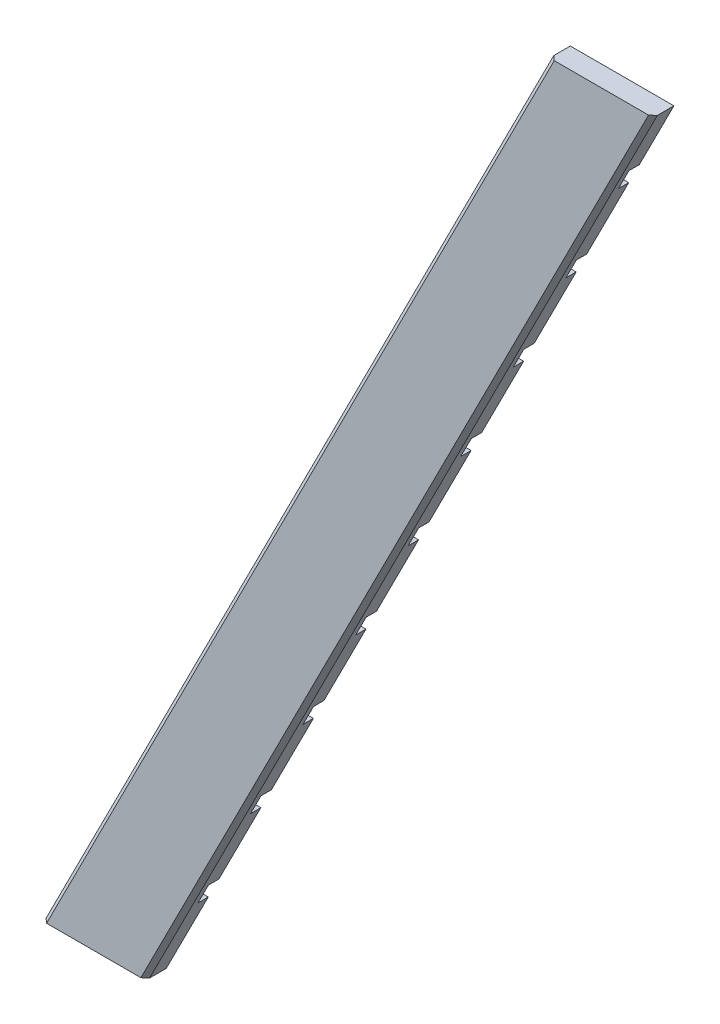
from build123d import *

# Parameters (mm, degrees)
EXTRUDE_1_DEPTH     = 1
SKETCH_2_W          = 34.447182458
SKETCH_2_H          = 1
CUT_EXTRUDE_1_DEPTH = 0.5
CHAMFER_1_SIZE      = 0.2


with BuildPart() as part:
    # Эскиз1 → Бобышка-Вытянуть1 (new body)
    with BuildSketch(Plane.XY):
        Polygon((0, 0), (24.5, 48.3), (19.5, 48.3), (-5, 0), align=None)
    extrude(amount=EXTRUDE_1_DEPTH)

    # Эскиз2 → Вырез-Вытянуть1 (cut)
    with BuildSketch(Plane.XY.offset(1)):
        with Locations((13.095064359, 4.5)):
            Rectangle(SKETCH_2_W, SKETCH_2_H)
        with Locations((13.095064359, 9.5)):
            Rectangle(SKETCH_2_W, SKETCH_2_H)
        with Locations((13.095064359, 14.5)):
            Rectangle(SKETCH_2_W, SKETCH_2_H)
        with Locations((13.095064359, 19.5)):
            Rectangle(SKETCH_2_W, SKETCH_2_H)
        with Locations((13.095064359, 24.5)):
            Rectangle(SKETCH_2_W, SKETCH_2_H)
        with Locations((13.095064359, 29.5)):
            Rectangle(SKETCH_2_W, SKETCH_2_H)
        with Locations((13.095064359, 34.5)):
            Rectangle(SKETCH_2_W, SKETCH_2_H)
        with Locations((13.095064359, 39.5)):
            Rectangle(SKETCH_2_W, SKETCH_2_H)
        with Locations((13.095064359, 44.5)):
            Rectangle(SKETCH_2_W, SKETCH_2_H)
    extrude(amount=-CUT_EXTRUDE_1_DEPTH, mode=Mode.SUBTRACT)


with BuildPart() as body_2:
    # Зеркальное отражение1: mirrored copy
    add(part.part.mirror(Plane.XY.offset(1)))

    # Фаска1
    chamfer_1_edges = [body_2.edges().sort_by_distance(p)[0] for p in [
        (7.25, 24.15, 2),
        (12.25, 24.15, 2),
    ]]
    chamfer(chamfer_1_edges, length=CHAMFER_1_SIZE)


solid = body_2.part
